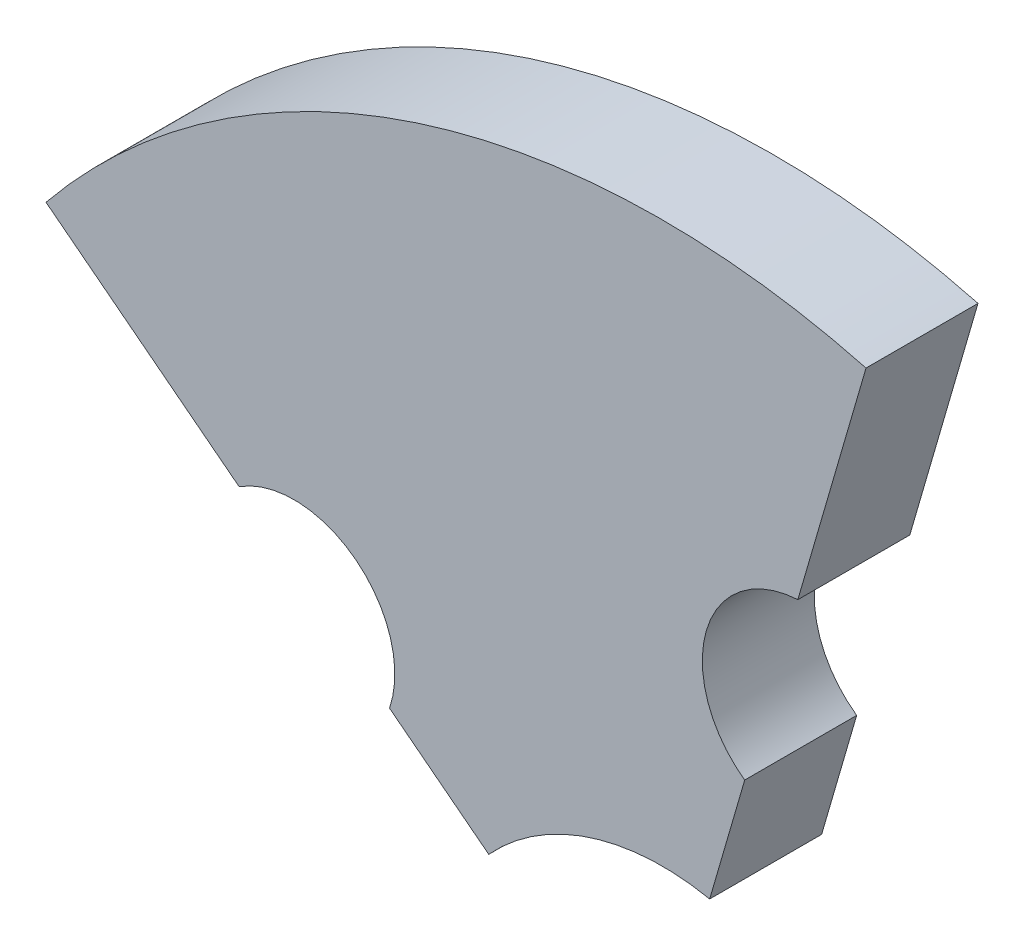
from build123d import *

# Parameters (mm, degrees)
BOSS_EXTRUDE1_DEPTH = 6.35
CUT_EXTRUDE1_DEPTH  = 58.404294318


with BuildPart() as part:
    # Sketch13 → Boss-Extrude1 (new body)
    with BuildSketch(Plane.XY):
        with BuildLine():
            Line((11.551437691, 43.580058654), (2.682196049, 13.0624672))
            ThreePointArc((2.682196049, 13.0624672), (-4.12074162, 12.682338645), (-9.847867764, 8.991202672))
            Line((-9.847867764, 8.991202672), (-34.961025172, 28.467243349))
            ThreePointArc((-34.961025172, 28.467243349), (-13.932031191, 42.878383037), (11.551437691, 43.580058654))
        make_face()
    extrude(amount=-BOSS_EXTRUDE1_DEPTH)

    # Sketch15 → Cut-Extrude1 (cut, through all)
    with BuildSketch(Plane.XY):
        with BuildLine():
            Line((7.682261651, 30.266864763), (4.669640038, 19.900932781))
            ThreePointArc((4.669640038, 19.900932781), (2.491973647, 26.154562688), (7.682261651, 30.266864763))
        make_face()
        with BuildLine():
            Line((-24.005496972, 19.970887857), (-15.475292944, 13.355447276))
            ThreePointArc((-15.475292944, 13.355447276), (-17.389315258, 19.694740336), (-24.005496972, 19.970887857))
        make_face()
    extrude(amount=-CUT_EXTRUDE1_DEPTH, mode=Mode.SUBTRACT)


solid = part.part
